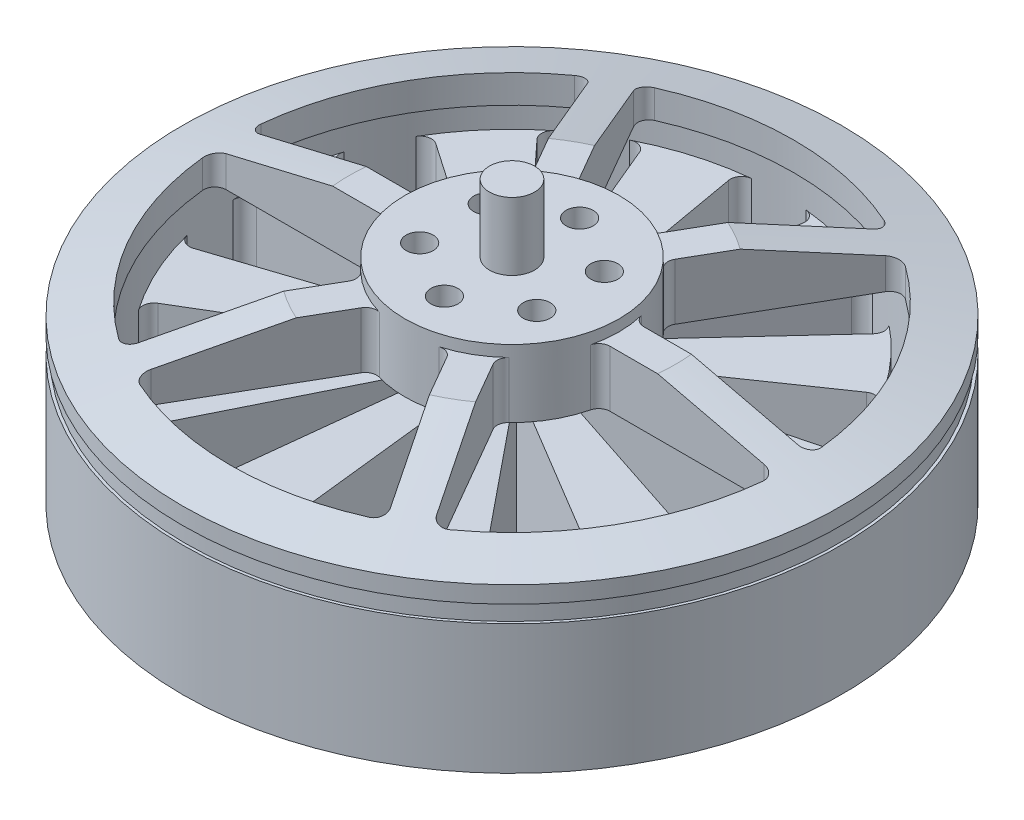
from build123d import *
from build123d.topology import SkipClean

# Parameters (mm, degrees)
SKETCH1_R           = 6
SKETCH1_R_2         = 1.2
BOSS_EXTRUDE1_DEPTH = 4.4
BOSS_EXTRUDE2_DEPTH = 4.4
BOSS_EXTRUDE3_START = -4.4
BOSS_EXTRUDE3_DEPTH = 4.4
BOSS_EXTRUDE4_START = 6
SKETCH4_R           = 3
BOSS_EXTRUDE4_DEPTH = 6
SKETCH5_R           = 2
BOSS_EXTRUDE5_DEPTH = 25
CUT_EXTRUDE1_DEPTH  = 19
SKETCH8_W           = 23.8
SKETCH8_H           = 12
CUT_EXTRUDE2_START  = -12
CUT_EXTRUDE2_DEPTH  = 12
SKETCH10_R          = 1.2
CUT_EXTRUDE3_DEPTH  = 6
SKETCH11_W          = 2
SKETCH11_H          = 1.5


with BuildPart() as part:
    # Sketch1 → Boss-Extrude1 (new body)
    with BuildSketch(Plane(origin=(0, 0, 0), x_dir=(1, 0, 0), z_dir=(0, 1, 0))):
        with BuildLine():
            Line((14.5, -3), (12.1346611, -3))
            ThreePointArc((12.1346611, -3), (8.838834765, -8.838834765), (3, -12.1346611))
            Line((3, -12.1346611), (3, -14.5))
            ThreePointArc((3, -14.5), (2.707106781, -15.207106781), (2, -15.5))
            Line((2, -15.5), (-2, -15.5))
            ThreePointArc((-2, -15.5), (-2.707106781, -15.207106781), (-3, -14.5))
            Line((-3, -14.5), (-3, -12.1346611))
            ThreePointArc((-3, -12.1346611), (-8.838834765, -8.838834765), (-12.1346611, -3))
            Line((-12.1346611, -3), (-14.5, -3))
            ThreePointArc((-14.5, -3), (-15.207106781, -2.707106781), (-15.5, -2))
            Line((-15.5, -2), (-15.5, 2))
            ThreePointArc((-15.5, 2), (-15.207106781, 2.707106781), (-14.5, 3))
            Line((-14.5, 3), (-12.1346611, 3))
            ThreePointArc((-12.1346611, 3), (-8.838834765, 8.838834765), (-3, 12.1346611))
            Line((-3, 12.1346611), (-3, 14.5))
            ThreePointArc((-3, 14.5), (-2.707106781, 15.207106781), (-2, 15.5))
            Line((-2, 15.5), (2, 15.5))
            ThreePointArc((2, 15.5), (2.707106781, 15.207106781), (3, 14.5))
            Line((3, 14.5), (3, 12.1346611))
            ThreePointArc((3, 12.1346611), (8.838834765, 8.838834765), (12.1346611, 3))
            Line((12.1346611, 3), (14.5, 3))
            ThreePointArc((14.5, 3), (15.207106781, 2.707106781), (15.5, 2))
            Line((15.5, 2), (15.5, -2))
            ThreePointArc((15.5, -2), (15.207106781, -2.707106781), (14.5, -3))
        make_face()
        with Locations(Location((0, 0, 0), (0, 0, 270))):
            Circle(SKETCH1_R, mode=Mode.SUBTRACT)
        with Locations(Location((0, 12.5, 0), (0, 0, 270))):
            Circle(SKETCH1_R_2, mode=Mode.SUBTRACT)
        with Locations(Location((12.5, 0, 0), (0, 0, 270))):
            Circle(SKETCH1_R_2, mode=Mode.SUBTRACT)
        with Locations(Location((0, -12.5, 0), (0, 0, 270))):
            Circle(SKETCH1_R_2, mode=Mode.SUBTRACT)
        with Locations(Location((-12.5, 0, 0), (0, 0, 270))):
            Circle(SKETCH1_R_2, mode=Mode.SUBTRACT)
        with BuildLine():
            ThreePointArc((-3.564705882, 9.450019681), (-7.14177849, 7.14177849), (-9.450019681, 3.564705882))
            ThreePointArc((-9.450019681, 3.564705882), (-8.517692743, 1.502967179), (-6.45595404, 2.435294118))
            ThreePointArc((-6.45595404, 2.435294118), (-4.87903679, 4.87903679), (-2.435294118, 6.45595404))
            ThreePointArc((-2.435294118, 6.45595404), (-1.502967179, 8.517692743), (-3.564705882, 9.450019681))
        make_face(mode=Mode.SUBTRACT)
        with BuildLine():
            ThreePointArc((9.450019681, 3.564705882), (7.14177849, 7.14177849), (3.564705882, 9.450019681))
            ThreePointArc((3.564705882, 9.450019681), (1.502967179, 8.517692743), (2.435294118, 6.45595404))
            ThreePointArc((2.435294118, 6.45595404), (4.87903679, 4.87903679), (6.45595404, 2.435294118))
            ThreePointArc((6.45595404, 2.435294118), (8.517692743, 1.502967179), (9.450019681, 3.564705882))
        make_face(mode=Mode.SUBTRACT)
        with BuildLine():
            ThreePointArc((3.564705882, -9.450019681), (7.14177849, -7.14177849), (9.450019681, -3.564705882))
            ThreePointArc((9.450019681, -3.564705882), (8.517692743, -1.502967179), (6.45595404, -2.435294118))
            ThreePointArc((6.45595404, -2.435294118), (4.87903679, -4.87903679), (2.435294118, -6.45595404))
            ThreePointArc((2.435294118, -6.45595404), (1.502967179, -8.517692743), (3.564705882, -9.450019681))
        make_face(mode=Mode.SUBTRACT)
        with BuildLine():
            ThreePointArc((-9.450019681, -3.564705882), (-7.14177849, -7.14177849), (-3.564705882, -9.450019681))
            ThreePointArc((-3.564705882, -9.450019681), (-1.502967179, -8.517692743), (-2.435294118, -6.45595404))
            ThreePointArc((-2.435294118, -6.45595404), (-4.87903679, -4.87903679), (-6.45595404, -2.435294118))
            ThreePointArc((-6.45595404, -2.435294118), (-8.517692743, -1.502967179), (-9.450019681, -3.564705882))
        make_face(mode=Mode.SUBTRACT)
    extrude(amount=BOSS_EXTRUDE1_DEPTH)

    # Sketch2 → Boss-Extrude2 (add)
    with BuildSketch(Plane(origin=(0, 4.4, 0), x_dir=(1, 0, 0), z_dir=(0, 1, 0))):
        with BuildLine():
            ThreePointArc((-12.1346611, -3), (-8.838834765, -8.838834765), (-3, -12.1346611))
            ThreePointArc((-3, -12.1346611), (-2.812658195, -11.394366069), (-2.445740031, -10.7246611))
            ThreePointArc((-2.445740031, -10.7246611), (-7.778174593, -7.778174593), (-10.7246611, -2.445740031))
            ThreePointArc((-10.7246611, -2.445740031), (-11.394366069, -2.812658195), (-12.1346611, -3))
        make_face()
        with BuildLine():
            ThreePointArc((-3, 12.1346611), (-2.812658195, 11.394366069), (-2.445740031, 10.7246611))
            ThreePointArc((-2.445740031, 10.7246611), (-7.778174593, 7.778174593), (-10.7246611, 2.445740031))
            ThreePointArc((-10.7246611, 2.445740031), (-11.394366069, 2.812658195), (-12.1346611, 3))
            ThreePointArc((-12.1346611, 3), (-8.838834765, 8.838834765), (-3, 12.1346611))
        make_face()
        with BuildLine():
            ThreePointArc((12.1346611, 3), (11.394366069, 2.812658195), (10.7246611, 2.445740031))
            ThreePointArc((10.7246611, 2.445740031), (7.778174593, 7.778174593), (2.445740031, 10.7246611))
            ThreePointArc((2.445740031, 10.7246611), (2.812658195, 11.394366069), (3, 12.1346611))
            ThreePointArc((3, 12.1346611), (8.838834765, 8.838834765), (12.1346611, 3))
        make_face()
        with BuildLine():
            ThreePointArc((3, -12.1346611), (2.812658195, -11.394366069), (2.445740031, -10.7246611))
            ThreePointArc((2.445740031, -10.7246611), (7.778174593, -7.778174593), (10.7246611, -2.445740031))
            ThreePointArc((10.7246611, -2.445740031), (11.394366069, -2.812658195), (12.1346611, -3))
            ThreePointArc((12.1346611, -3), (8.838834765, -8.838834765), (3, -12.1346611))
        make_face()
    extrude(amount=BOSS_EXTRUDE2_DEPTH)

    # Sketch3 → Boss-Extrude3 (add)
    with BuildSketch(Plane(origin=(0, 8.8, 0), x_dir=(1, 0, 0), z_dir=(0, 1, 0)).offset(BOSS_EXTRUDE3_START)):
        with BuildLine():
            Line((-8.453073474, 7.038859911), (-2.707106781, 1.292893219))
            ThreePointArc((-2.707106781, 1.292893219), (-3, 0), (-2.707106781, -1.292893219))
            Line((-2.707106781, -1.292893219), (-8.453073474, -7.038859911))
            ThreePointArc((-8.453073474, -7.038859911), (-7.778174593, -7.778174593), (-7.038859911, -8.453073474))
            Line((-7.038859911, -8.453073474), (-1.292893219, -2.707106781))
            ThreePointArc((-1.292893219, -2.707106781), (0, -3), (1.292893219, -2.707106781))
            Line((1.292893219, -2.707106781), (7.038859911, -8.453073474))
            ThreePointArc((7.038859911, -8.453073474), (7.778174593, -7.778174593), (8.453073474, -7.038859911))
            Line((8.453073474, -7.038859911), (2.707106781, -1.292893219))
            ThreePointArc((2.707106781, -1.292893219), (3, 0), (2.707106781, 1.292893219))
            Line((2.707106781, 1.292893219), (8.453073474, 7.038859911))
            ThreePointArc((8.453073474, 7.038859911), (7.778174593, 7.778174593), (7.038859911, 8.453073474))
            Line((7.038859911, 8.453073474), (1.292893219, 2.707106781))
            ThreePointArc((1.292893219, 2.707106781), (0, 3), (-1.292893219, 2.707106781))
            Line((-1.292893219, 2.707106781), (-7.038859911, 8.453073474))
            ThreePointArc((-7.038859911, 8.453073474), (-7.778174593, 7.778174593), (-8.453073474, 7.038859911))
        make_face()
    extrude(amount=BOSS_EXTRUDE3_DEPTH)

    # Sketch4 → Boss-Extrude4 (add)
    with SkipClean():  # the faces are left unmerged after this step: merging them gives an invalid solid
        with BuildSketch(Plane.XZ.offset(-4.4).offset(BOSS_EXTRUDE4_START)):
            with Locations(Location((0, 0, 0), (0, 0, 115.528779366))):
                Circle(SKETCH4_R)
        extrude(amount=-BOSS_EXTRUDE4_DEPTH)

    # Sketch5 → Boss-Extrude5 (add)
    with SkipClean():  # the faces are left unmerged after this step: merging them gives an invalid solid
        with BuildSketch(Plane(origin=(0, 8.8, 0), x_dir=(1, 0, 0), z_dir=(0, 1, 0))):
            with Locations(Location((0, 0, 0), (0, 0, 270))):
                Circle(SKETCH5_R)
        extrude(amount=BOSS_EXTRUDE5_DEPTH)

    # Sketch6 → Revolve2 (revolve)
    with SkipClean():  # the faces are left unmerged after this step: merging them gives an invalid solid
        with BuildSketch(Plane.XY, mode=Mode.PRIVATE) as revolve2_sk:
            Polygon((-25.25, 8.8), (-29.25, 8.8), (-29.25, 23.3), (-14.5, 26.8), (-9.5, 26.8), (-9.5, 27.8), (0, 27.8), (0, 21.8), (-25.25, 21.8), align=None)
        revolve(revolve2_sk.sketch.rotate(Axis((0, 28.437726439, 0), (0, -1, 0)), 270), axis=Axis((0, 28.437726439, 0), (0, -1, 0)))

    # Sketch7 → Cut-Extrude1 (cut)
    with SkipClean():  # the faces are left unmerged after this step: merging them gives an invalid solid
        with BuildSketch(Plane(origin=(0, 26.8, 0), x_dir=(1, 0, 0), z_dir=(0, 1, 0))):
            with BuildLine():
                Line((-10.635680157, 21.421538404), (-3.799981408, 9.581760866))
                ThreePointArc((-3.799981408, 9.581760866), (-3.306734448, 9.153840486), (-2.654531623, 9.121593165))
                ThreePointArc((-2.654531623, 9.121593165), (0, 9.5), (2.654531623, 9.121593165))
                ThreePointArc((2.654531623, 9.121593165), (3.306734448, 9.153840486), (3.799981408, 9.581760866))
                Line((3.799981408, 9.581760866), (10.635680157, 21.421538404))
                ThreePointArc((10.635680157, 21.421538404), (10.720767461, 22.230382405), (10.176723701, 22.834935838))
                ThreePointArc((10.176723701, 22.834935838), (0, 25), (-10.176723701, 22.834935838))
                ThreePointArc((-10.176723701, 22.834935838), (-10.720767461, 22.230382405), (-10.635680157, 21.421538404))
            make_face()
            with BuildLine():
                Line((13.233756368, 19.921538404), (6.398057619, 8.081760866))
                ThreePointArc((6.398057619, 8.081760866), (6.274091179, 7.440636279), (6.572265592, 6.859688403))
                ThreePointArc((6.572265592, 6.859688403), (8.227241336, 4.75), (9.226797215, 2.261904762))
                ThreePointArc((9.226797215, 2.261904762), (9.580825627, 1.713204208), (10.198039027, 1.5))
                Line((10.198039027, 1.5), (23.869436525, 1.5))
                ThreePointArc((23.869436525, 1.5), (24.612459629, 1.830734233), (24.86399638, 2.604166667))
                ThreePointArc((24.86399638, 2.604166667), (21.650635095, 12.5), (14.687272679, 20.230769171))
                ThreePointArc((14.687272679, 20.230769171), (13.891692168, 20.399648172), (13.233756368, 19.921538404))
            make_face()
            with BuildLine():
                Line((23.869436525, -1.5), (10.198039027, -1.5))
                ThreePointArc((10.198039027, -1.5), (9.580825627, -1.713204208), (9.226797215, -2.261904762))
                ThreePointArc((9.226797215, -2.261904762), (8.227241336, -4.75), (6.572265592, -6.859688403))
                ThreePointArc((6.572265592, -6.859688403), (6.274091179, -7.440636279), (6.398057619, -8.081760866))
                Line((6.398057619, -8.081760866), (13.233756368, -19.921538404))
                ThreePointArc((13.233756368, -19.921538404), (13.891692168, -20.399648172), (14.687272679, -20.230769171))
                ThreePointArc((14.687272679, -20.230769171), (21.650635095, -12.5), (24.86399638, -2.604166667))
                ThreePointArc((24.86399638, -2.604166667), (24.612459629, -1.830734233), (23.869436525, -1.5))
            make_face()
            with BuildLine():
                Line((10.635680157, -21.421538404), (3.799981408, -9.581760866))
                ThreePointArc((3.799981408, -9.581760866), (3.306734448, -9.153840486), (2.654531623, -9.121593165))
                ThreePointArc((2.654531623, -9.121593165), (0, -9.5), (-2.654531623, -9.121593165))
                ThreePointArc((-2.654531623, -9.121593165), (-3.306734448, -9.153840486), (-3.799981408, -9.581760866))
                Line((-3.799981408, -9.581760866), (-10.635680157, -21.421538404))
                ThreePointArc((-10.635680157, -21.421538404), (-10.720767461, -22.230382405), (-10.176723701, -22.834935838))
                ThreePointArc((-10.176723701, -22.834935838), (0, -25), (10.176723701, -22.834935838))
                ThreePointArc((10.176723701, -22.834935838), (10.720767461, -22.230382405), (10.635680157, -21.421538404))
            make_face()
            with BuildLine():
                Line((-13.233756368, -19.921538404), (-6.398057619, -8.081760866))
                ThreePointArc((-6.398057619, -8.081760866), (-6.274091179, -7.440636279), (-6.572265592, -6.859688403))
                ThreePointArc((-6.572265592, -6.859688403), (-8.227241336, -4.75), (-9.226797215, -2.261904762))
                ThreePointArc((-9.226797215, -2.261904762), (-9.580825627, -1.713204208), (-10.198039027, -1.5))
                Line((-10.198039027, -1.5), (-23.869436525, -1.5))
                ThreePointArc((-23.869436525, -1.5), (-24.612459629, -1.830734233), (-24.86399638, -2.604166667))
                ThreePointArc((-24.86399638, -2.604166667), (-21.650635095, -12.5), (-14.687272679, -20.230769171))
                ThreePointArc((-14.687272679, -20.230769171), (-13.891692168, -20.399648172), (-13.233756368, -19.921538404))
            make_face()
            with BuildLine():
                Line((-23.869436525, 1.5), (-10.198039027, 1.5))
                ThreePointArc((-10.198039027, 1.5), (-9.580825627, 1.713204208), (-9.226797215, 2.261904762))
                ThreePointArc((-9.226797215, 2.261904762), (-8.227241336, 4.75), (-6.572265592, 6.859688403))
                ThreePointArc((-6.572265592, 6.859688403), (-6.274091179, 7.440636279), (-6.398057619, 8.081760866))
                Line((-6.398057619, 8.081760866), (-13.233756368, 19.921538404))
                ThreePointArc((-13.233756368, 19.921538404), (-13.891692168, 20.399648172), (-14.687272679, 20.230769171))
                ThreePointArc((-14.687272679, 20.230769171), (-21.650635095, 12.5), (-24.86399638, 2.604166667))
                ThreePointArc((-24.86399638, 2.604166667), (-24.612459629, 1.830734233), (-23.869436525, 1.5))
            make_face()
        extrude(amount=-CUT_EXTRUDE1_DEPTH, mode=Mode.SUBTRACT)

    # Sketch8 → Revolve3 (revolve)
    with SkipClean():  # the faces are left unmerged after this step: merging them gives an invalid solid
        with BuildSketch(Plane.XY, mode=Mode.PRIVATE) as revolve3_sk:
            with Locations((-11.9, 14.8)):
                Rectangle(SKETCH8_W, SKETCH8_H)
        revolve(revolve3_sk.sketch.rotate(Axis((0, 34.831731162, 0), (0, -1, 0)), 125.405931773), axis=Axis((0, 34.831731162, 0), (0, -1, 0)))

    # Sketch9 → Cut-Extrude2 (cut)
    with SkipClean():  # the faces are left unmerged after this step: merging them gives an invalid solid
        with BuildSketch(Plane(origin=(0, 20.8, 0), x_dir=(1, 0, 0), z_dir=(0, 1, 0)).offset(CUT_EXTRUDE2_START)):
            with BuildLine():
                Line((-3.290331379, 22.509485663), (0, 3.849089134))
                Line((0, 3.849089134), (3.290331379, 22.509485663))
                ThreePointArc((3.290331379, 22.509485663), (3.103126702, 23.28631651), (2.406643083, 23.678008131))
                ThreePointArc((2.406643083, 23.678008131), (0, 23.8), (-2.406643083, 23.678008131))
                ThreePointArc((-2.406643083, 23.678008131), (-3.103126702, 23.28631651), (-3.290331379, 22.509485663))
            make_face()
            with BuildLine():
                Line((9.401543833, 20.715071782), (2.080974696, 3.238059832))
                Line((2.080974696, 3.238059832), (14.937549626, 17.15729689))
                ThreePointArc((14.937549626, 17.15729689), (15.200049494, 17.912019074), (14.825894668, 18.618078507))
                ThreePointArc((14.825894668, 18.618078507), (12.867251455, 20.021834081), (10.776700676, 21.220337475))
                ThreePointArc((10.776700676, 21.220337475), (9.979016893, 21.267372987), (9.401543833, 20.715071782))
            make_face()
            with BuildLine():
                Line((19.108495305, 12.343768977), (3.501254629, 1.598969413))
                Line((3.501254629, 1.598969413), (21.84220141, 6.357787582))
                ThreePointArc((21.84220141, 6.357787582), (22.471063971, 6.850782142), (22.53802945, 7.647040506))
                ThreePointArc((22.53802945, 7.647040506), (21.649241489, 9.886877309), (20.538518115, 12.025359605))
                ThreePointArc((20.538518115, 12.025359605), (19.892893133, 12.496188809), (19.108495305, 12.343768977))
            make_face()
            with BuildLine():
                Line((22.748634532, 0.053406738), (3.809910956, -0.547782498))
                Line((3.809910956, -0.547782498), (21.812108576, -6.460274361))
                ThreePointArc((21.812108576, -6.460274361), (22.60767441, -6.385529714), (23.094499128, -5.751878824))
                ThreePointArc((23.094499128, -5.751878824), (23.557750317, -3.387093151), (23.779501171, -0.987584971))
                ThreePointArc((23.779501171, -0.987584971), (23.490916359, -0.242447022), (22.748634532, 0.053406738))
            make_face()
            with BuildLine():
                Line((19.16624303, -12.253911763), (2.908947475, -2.520617335))
                Line((2.908947475, -2.520617335), (14.856825387, -17.227244841))
                ThreePointArc((14.856825387, -17.227244841), (15.566507962, -17.594481005), (16.318628511, -17.324617269))
                ThreePointArc((16.318628511, -17.324617269), (17.98683987, -15.585685468), (19.470660623, -13.686978298))
                ThreePointArc((19.470660623, -13.686978298), (19.63073962, -12.904107637), (19.16624303, -12.253911763))
            make_face()
            with BuildLine():
                Line((9.498704788, -20.670699861), (1.084413723, -3.693173979))
                Line((1.084413723, -3.693173979), (3.18460511, -22.524686805))
                ThreePointArc((3.18460511, -22.524686805), (3.583085223, -23.217308893), (4.361708644, -23.39691214))
                ThreePointArc((4.361708644, -23.39691214), (6.705234853, -22.835932772), (8.9800229, -22.040852722))
                ThreePointArc((8.9800229, -22.040852722), (9.537941756, -21.468805253), (9.498704788, -20.670699861))
            make_face()
            with BuildLine():
                Line((-3.18460511, -22.524686805), (-1.084413723, -3.693173979))
                Line((-1.084413723, -3.693173979), (-9.498704788, -20.670699861))
                ThreePointArc((-9.498704788, -20.670699861), (-9.537941756, -21.468805253), (-8.9800229, -22.040852722))
                ThreePointArc((-8.9800229, -22.040852722), (-6.705234853, -22.835932772), (-4.361708644, -23.39691214))
                ThreePointArc((-4.361708644, -23.39691214), (-3.583085223, -23.217308893), (-3.18460511, -22.524686805))
            make_face()
            with BuildLine():
                Line((-14.856825387, -17.227244841), (-2.908947475, -2.520617335))
                Line((-2.908947475, -2.520617335), (-19.16624303, -12.253911763))
                ThreePointArc((-19.16624303, -12.253911763), (-19.63073962, -12.904107637), (-19.470660623, -13.686978298))
                ThreePointArc((-19.470660623, -13.686978298), (-17.98683987, -15.585685468), (-16.318628511, -17.324617269))
                ThreePointArc((-16.318628511, -17.324617269), (-15.566507962, -17.594481005), (-14.856825387, -17.227244841))
            make_face()
            with BuildLine():
                Line((-21.812108576, -6.460274361), (-3.809910956, -0.547782498))
                Line((-3.809910956, -0.547782498), (-22.748634532, 0.053406738))
                ThreePointArc((-22.748634532, 0.053406738), (-23.490916359, -0.242447022), (-23.779501171, -0.987584971))
                ThreePointArc((-23.779501171, -0.987584971), (-23.557750317, -3.387093151), (-23.094499128, -5.751878824))
                ThreePointArc((-23.094499128, -5.751878824), (-22.60767441, -6.385529714), (-21.812108576, -6.460274361))
            make_face()
            with BuildLine():
                Line((-21.84220141, 6.357787582), (-3.501254629, 1.598969413))
                Line((-3.501254629, 1.598969413), (-19.108495305, 12.343768977))
                ThreePointArc((-19.108495305, 12.343768977), (-19.892893133, 12.496188809), (-20.538518115, 12.025359605))
                ThreePointArc((-20.538518115, 12.025359605), (-21.649241489, 9.886877309), (-22.53802945, 7.647040506))
                ThreePointArc((-22.53802945, 7.647040506), (-22.471063971, 6.850782142), (-21.84220141, 6.357787582))
            make_face()
            with BuildLine():
                Line((-14.937549626, 17.15729689), (-2.080974696, 3.238059832))
                Line((-2.080974696, 3.238059832), (-9.401543833, 20.715071782))
                ThreePointArc((-9.401543833, 20.715071782), (-9.979016893, 21.267372987), (-10.776700676, 21.220337475))
                ThreePointArc((-10.776700676, 21.220337475), (-12.867251455, 20.021834081), (-14.825894668, 18.618078507))
                ThreePointArc((-14.825894668, 18.618078507), (-15.200049494, 17.912019074), (-14.937549626, 17.15729689))
            make_face()
        extrude(amount=CUT_EXTRUDE2_DEPTH, mode=Mode.SUBTRACT)

    # Sketch10 → Cut-Extrude3 (cut)
    with SkipClean():  # the faces are left unmerged after this step: merging them gives an invalid solid
        with BuildSketch(Plane(origin=(0, 27.8, 0), x_dir=(1, 0, 0), z_dir=(0, 1, 0))):
            with Locations(Location((0, 6, 0), (0, 0, 270))):
                Circle(SKETCH10_R)
            with Locations(Location((5.196152423, 3, 0), (0, 0, 270))):
                Circle(SKETCH10_R)
            with Locations(Location((5.196152423, -3, 0), (0, 0, 270))):
                Circle(SKETCH10_R)
            with Locations(Location((0, -6, 0), (0, 0, 270))):
                Circle(SKETCH10_R)
            with Locations(Location((-5.196152423, -3, 0), (0, 0, 270))):
                Circle(SKETCH10_R)
            with Locations(Location((-5.196152423, 3, 0), (0, 0, 270))):
                Circle(SKETCH10_R)
        extrude(amount=-CUT_EXTRUDE3_DEPTH, mode=Mode.SUBTRACT)

    # Sketch11 → Cut-Revolve1 (revolve, cut)
    with SkipClean():  # the faces are left unmerged after this step: merging them gives an invalid solid
        with BuildSketch(Plane.XY, mode=Mode.PRIVATE) as cut_revolve1_sk:
            with Locations((-30, 21.05)):
                Rectangle(SKETCH11_W, SKETCH11_H)
        revolve(cut_revolve1_sk.sketch.rotate(Axis((0, 34.709434767, 0), (0, -1, 0)), 270), axis=Axis((0, 34.709434767, 0), (0, -1, 0)), mode=Mode.SUBTRACT)


solid = part.part
